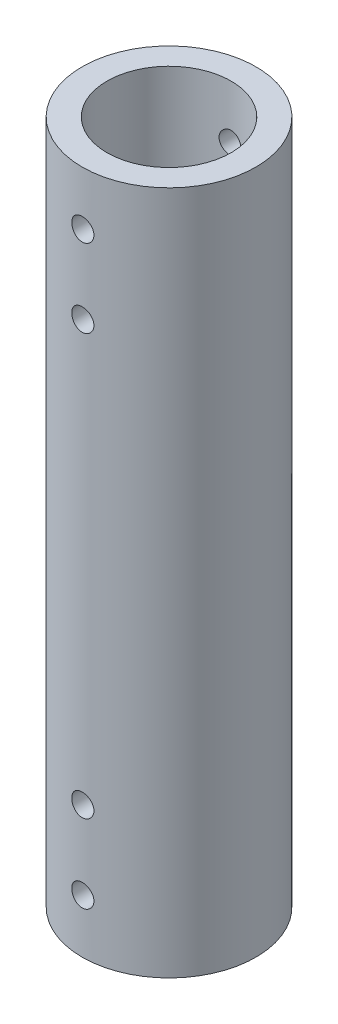
from build123d import *

# Parameters (mm, degrees)
SKETCH1_R           = 13.335
SKETCH1_R_2         = 9.525
BOSS_EXTRUDE1_DEPTH = 105
SKETCH4_R           = 1.7
CUT_EXTRUDE1_DEPTH  = 107.680103346


with BuildPart() as part:
    # Sketch1 → Boss-Extrude1 (new body)
    with BuildSketch(Plane(origin=(0, 0, 0), x_dir=(1, 0, 0), z_dir=(0, 1, 0))):
        with Locations(Location((0, 0, 0), (0, 0, 270))):
            Circle(SKETCH1_R)
        with Locations(Location((0, 0, 0), (0, 0, 270))):
            Circle(SKETCH1_R_2, mode=Mode.SUBTRACT)
    extrude(amount=BOSS_EXTRUDE1_DEPTH)

    # Sketch4 → Cut-Extrude1 (cut, symmetric)
    with BuildSketch(Plane.XY):
        with Locations((0, 96.744231704)):
            Circle(SKETCH4_R)
        with Locations((0, 84.744231704)):
            Circle(SKETCH4_R)
    cut_extrude1 = extrude(amount=CUT_EXTRUDE1_DEPTH, both=True, mode=Mode.SUBTRACT)

    # Mirror2: Cut-Extrude1 across plane
    add(cut_extrude1.mirror(Plane.ZX.offset(52.5)), mode=Mode.SUBTRACT)


solid = part.part
